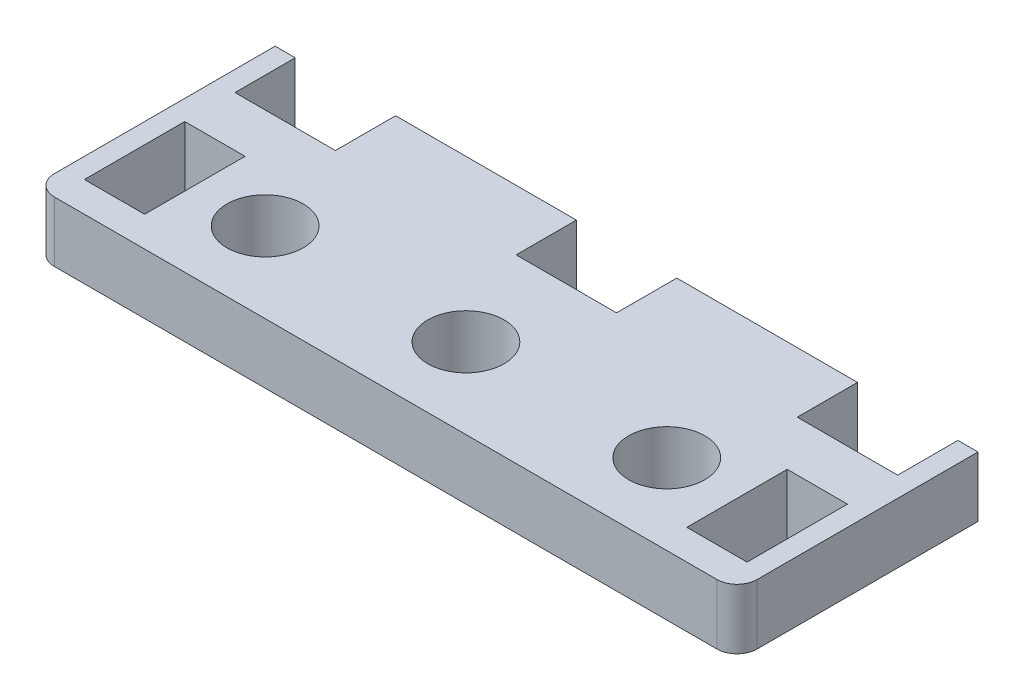
from build123d import *

# Parameters (mm, degrees)
SKETCH1_W             = 35
SKETCH1_H             = 12
BOSS_EXTRUDE1_DEPTH   = 3
SKETCH5_W             = 3
SKETCH5_H             = 5
SKETCH5_W_2           = 5
SKETCH5_H_2           = 3
CUT_EXTRUDE1_DEPTH    = 3
FILLET1_R             = 1
F_6_CLEARANCE_HOLE2_D = 3.7973


with BuildPart() as part:
    # Sketch1 → Boss-Extrude1 (new body)
    with BuildSketch(Plane(origin=(0, 0, 0), x_dir=(1, 0, 0), z_dir=(0, 1, 0))):
        Rectangle(SKETCH1_W, SKETCH1_H)
    extrude(amount=BOSS_EXTRUDE1_DEPTH)

    # Sketch5 → Cut-Extrude1 (cut)
    with BuildSketch(Plane(origin=(0, 3, 0), x_dir=(1, 0, 0), z_dir=(0, 1, 0))):
        with Locations((-15, -2)):
            Rectangle(SKETCH5_W, SKETCH5_H)
        with Locations((15, -2)):
            Rectangle(SKETCH5_W, SKETCH5_H)
        with Locations((-14, 4.5)):
            Rectangle(SKETCH5_W_2, SKETCH5_H_2)
        with Locations((0, 4.5)):
            Rectangle(SKETCH5_W_2, SKETCH5_H_2)
        with Locations((14, 4.5)):
            Rectangle(SKETCH5_W_2, SKETCH5_H_2)
    extrude(amount=-CUT_EXTRUDE1_DEPTH, mode=Mode.SUBTRACT)

    # Fillet1
    fillet1_edges = [part.edges().sort_by_distance(p)[0] for p in [
        (-17.5, 1.5, 6),
        (17.5, 1.5, 6),
    ]]
    fillet(fillet1_edges, radius=FILLET1_R)

    # #6 Clearance Hole2 (through all)
    with Locations(Plane(origin=(0, 3, 0), x_dir=(1, 0, 0), z_dir=(0, 1, 0))):
        with Locations((-10, -2), (0, -2), (10, -2)):
            Hole(F_6_CLEARANCE_HOLE2_D / 2)


solid = part.part
